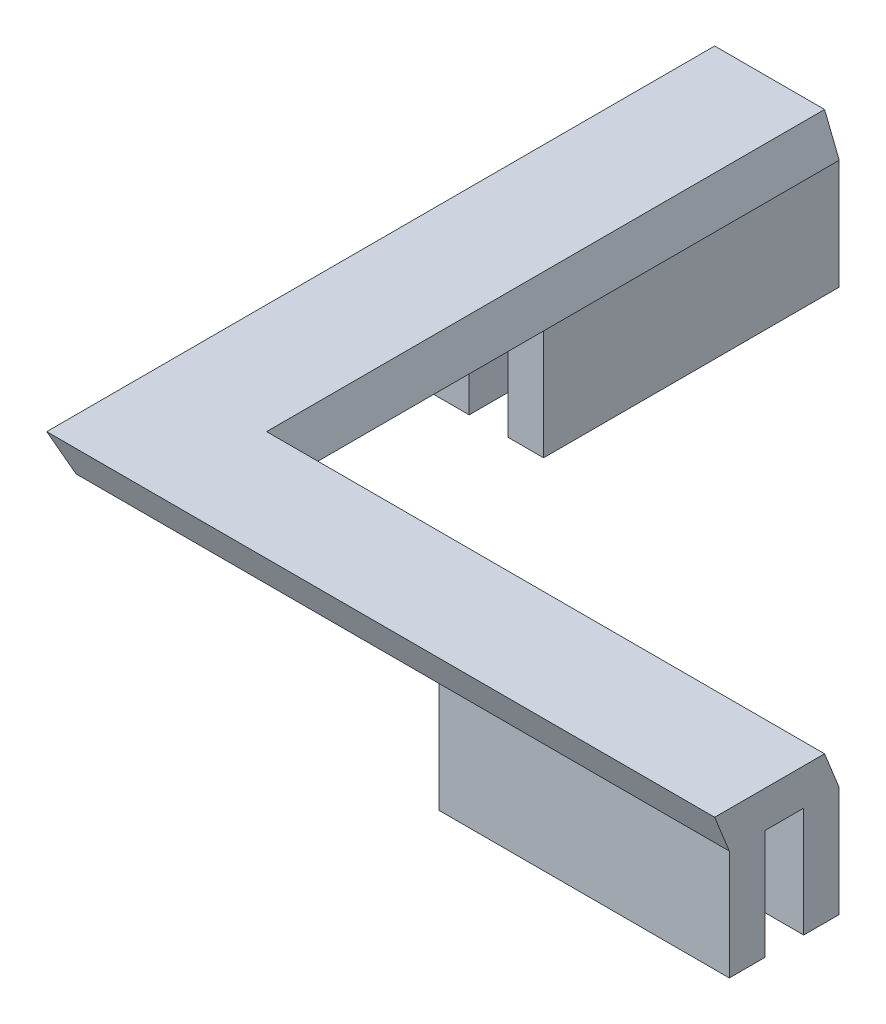
from build123d import *

# Parameters (mm, degrees)
SKETCH5_W           = 6.1595
SKETCH5_H           = 101.6
SKETCH5_W_2         = 101.6
SKETCH5_H_2         = 6.1595
BOSS_EXTRUDE1_DEPTH = 19.05
SKETCH6_W           = 333.025633445
SKETCH6_H           = 150.821732437
CUT_EXTRUDE1_DEPTH  = 205.486
SKETCH7_W           = 172.839732196
SKETCH7_H           = 155.996881263
CUT_EXTRUDE2_DEPTH  = 205.486
SKETCH8_W           = 181.528793167
SKETCH8_H           = 183.344081098
CUT_EXTRUDE3_DEPTH  = 147.066


with BuildPart() as part:
    # Sketch2 → Loft1 section 0
    with BuildSketch(Plane(origin=(0, 127, 0), x_dir=(1, 0, 0), z_dir=(0, 1, 0))):
        with BuildLine():
            Line((-50.8, -50.8), (278.13, -50.8))
            Line((278.13, -50.8), (278.13, 276.352))
            Line((278.13, 276.352), (-50.8, 276.352))
            Line((-50.8, 276.352), (-50.8, -50.8))
        make_face()
    # Sketch1 → Loft1 section 1
    with BuildSketch(Plane(origin=(0, 0, 0), x_dir=(1, 0, 0), z_dir=(0, 1, 0))):
        with BuildLine():
            Line((0, 0), (227.33, 0))
            Line((227.33, 0), (227.33, 225.552))
            Line((227.33, 225.552), (0, 225.552))
            Line((0, 225.552), (0, 0))
        make_face()
    loft()

    # Sketch4 → Cut-Loft3 section 0
    with BuildSketch(Plane.XZ):
        with BuildLine():
            Line((208.28, -19.05), (19.05, -19.05))
            Line((19.05, -19.05), (19.05, -206.502))
            Line((19.05, -206.502), (208.28, -206.502))
            Line((208.28, -206.502), (208.28, -19.05))
        make_face()
    # Sketch3 → Cut-Loft3 section 1
    with BuildSketch(Plane(origin=(0, 127, 0), x_dir=(1, 0, 0), z_dir=(0, 1, 0))):
        with BuildLine():
            Line((-31.75, 257.302), (-31.75, -31.75))
            Line((-31.75, -31.75), (259.08, -31.75))
            Line((259.08, -31.75), (259.08, 257.302))
            Line((259.08, 257.302), (-31.75, 257.302))
        make_face()
    loft(mode=Mode.SUBTRACT)

    # Sketch5 → Boss-Extrude1 (add)
    with BuildSketch(Plane.XZ):
        with Locations((3.07975, -112.776)):
            Rectangle(SKETCH5_W, SKETCH5_H)
        with Locations((15.97025, -112.776)):
            Rectangle(SKETCH5_W, SKETCH5_H)
        with Locations((113.665, -3.07975)):
            Rectangle(SKETCH5_W_2, SKETCH5_H_2)
        with Locations((113.665, -15.97025)):
            Rectangle(SKETCH5_W_2, SKETCH5_H_2)
        with Locations((223.36125, -113.665)):
            Rectangle(SKETCH5_W, SKETCH5_H)
        with Locations((210.47075, -113.665)):
            Rectangle(SKETCH5_W, SKETCH5_H)
        with Locations((112.776, -223.36125)):
            Rectangle(SKETCH5_W_2, SKETCH5_H_2)
        with Locations((112.776, -210.47075)):
            Rectangle(SKETCH5_W_2, SKETCH5_H_2)
    extrude(amount=BOSS_EXTRUDE1_DEPTH)

    # Sketch6 → Cut-Extrude1 (cut)
    with BuildSketch(Plane.XY.offset(-113.2205)):
        with Locations((111.617183278, 51.589133782)):
            Rectangle(SKETCH6_W, SKETCH6_H)
    extrude(amount=-CUT_EXTRUDE1_DEPTH, mode=Mode.SUBTRACT)

    # Sketch7 → Cut-Extrude2 (cut)
    with BuildSketch(Plane.ZY.offset(-113.2205)):
        with Locations((-29.906934154, 52.245596061)):
            Rectangle(SKETCH7_W, SKETCH7_H)
    extrude(amount=-CUT_EXTRUDE2_DEPTH, mode=Mode.SUBTRACT)

    # Sketch8 → Cut-Extrude3 (cut)
    with BuildSketch(Plane(origin=(0, 6.35, 0), x_dir=(-1, 0, 0), z_dir=(0, -1, 0))):
        with Locations((-25.634722782, 25.303882613)):
            Rectangle(SKETCH8_W, SKETCH8_H)
    extrude(amount=-CUT_EXTRUDE3_DEPTH, mode=Mode.SUBTRACT)


solid = part.part
